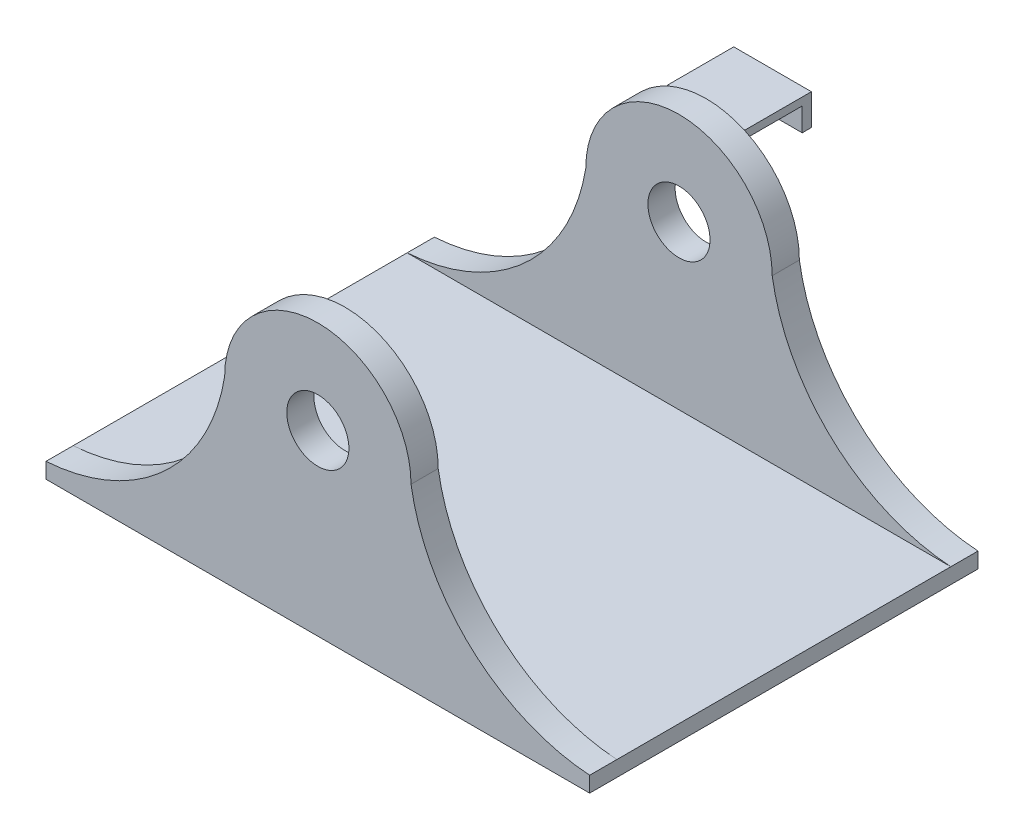
from build123d import *

# Parameters (mm, degrees)
BOSS_EXTRUDE1_DEPTH      = 50
CUT_EXTRUDE1_DEPTH       = 71.328210001
CUT_EXTRUDE1_DEPTH_BACK  = 71.328210001
SKETCH3_W                = 43
SKETCH3_H                = 41.467755669
BOSS_EXTRUDE3_DEPTH      = 5
BOSS_EXTRUDE3_DEPTH_BACK = 5
CUT_EXTRUDE2_REACH       = 78.643
SKETCH6_R                = 1


with BuildPart() as part:
    # Sketch1 → Boss-Extrude1 (new body)
    with BuildSketch(Plane.XY):
        with BuildLine():
            Line((0, 34.943627773), (0, 26.943627773))
            ThreePointArc((0, 26.943627773), (-4, 22.943627773), (0, 18.943627773))
            Line((0, 18.943627773), (0, 0))
            Line((0, 0), (-35, 0))
            Line((-35, 0), (-35, 2))
            ThreePointArc((-35, 2), (-19.845914105, 8.458947707), (-12, 22.943627773))
            ThreePointArc((-12, 22.943627773), (-8.485281374, 31.428909148), (0, 34.943627773))
        make_face()
    boss_extrude1 = extrude(amount=BOSS_EXTRUDE1_DEPTH)

    # Mirror1: Boss-Extrude1 across plane
    add(boss_extrude1.mirror(Plane(origin=(0, 18.943627773, 50), x_dir=(0, 0, 1), z_dir=(-1, 0, 0))))

    # Sketch3 → Cut-Extrude1 (cut, two sides: drawn at the far end of the back side and taken through both)
    with BuildSketch(Plane(origin=(0, 0, 0), x_dir=(0, 0, -1), z_dir=(1, 0, 0)).offset(-CUT_EXTRUDE1_DEPTH_BACK)):
        with Locations((-25, 22.733877835)):
            Rectangle(SKETCH3_W, SKETCH3_H)
    extrude(amount=CUT_EXTRUDE1_DEPTH + CUT_EXTRUDE1_DEPTH_BACK, mode=Mode.SUBTRACT)

    # Sketch5 → Boss-Extrude3 (add, two sides: drawn at the far end of the back side and taken through both)
    with BuildSketch(Plane.ZY.offset(-BOSS_EXTRUDE3_DEPTH_BACK)):
        Polygon((-7.365906047, 6.54), (-7.365906047, 1.184093953), (0, 1.184093953), (0, 0), (-8.55, 0), (-8.55, 6.54), align=None)
        Polygon((0, 32.943627773), (0, 33.943627773), (-8.55, 33.943627773), (-8.55, 29.943627773), (-7.365906047, 29.943627773), (-7.365906047, 32.943627773), align=None)
    extrude(amount=BOSS_EXTRUDE3_DEPTH + BOSS_EXTRUDE3_DEPTH_BACK)

    # Sketch6 → Cut-Extrude2 (cut, up to next)
    with BuildSketch(Plane(origin=(0, 0, -8.55), x_dir=(-1, 0, 0), z_dir=(0, 0, -1)), mode=Mode.PRIVATE) as cut_extrude2_sk1:
        with Locations((0, 3.88)):
            Circle(SKETCH6_R)
    cut_extrude2_tool1 = extrude(cut_extrude2_sk1.sketch, amount=-CUT_EXTRUDE2_REACH, mode=Mode.PRIVATE) & part.part
    # Sketch6 → Cut-Extrude2 (cut, up to next)
    with BuildSketch(Plane(origin=(0, 0, -8.55), x_dir=(-1, 0, 0), z_dir=(0, 0, -1)), mode=Mode.PRIVATE) as cut_extrude2_sk2:
        with Locations((0, 31.690394603)):
            Circle(SKETCH6_R)
    cut_extrude2_tool2 = extrude(cut_extrude2_sk2.sketch, amount=-CUT_EXTRUDE2_REACH, mode=Mode.PRIVATE) & part.part
    add(cut_extrude2_tool1.solids().sort_by_distance((0, 3.88, -8.55))[0], mode=Mode.SUBTRACT)
    add(cut_extrude2_tool2.solids().sort_by_distance((0, 31.690395, -8.55))[0], mode=Mode.SUBTRACT)


solid = part.part
